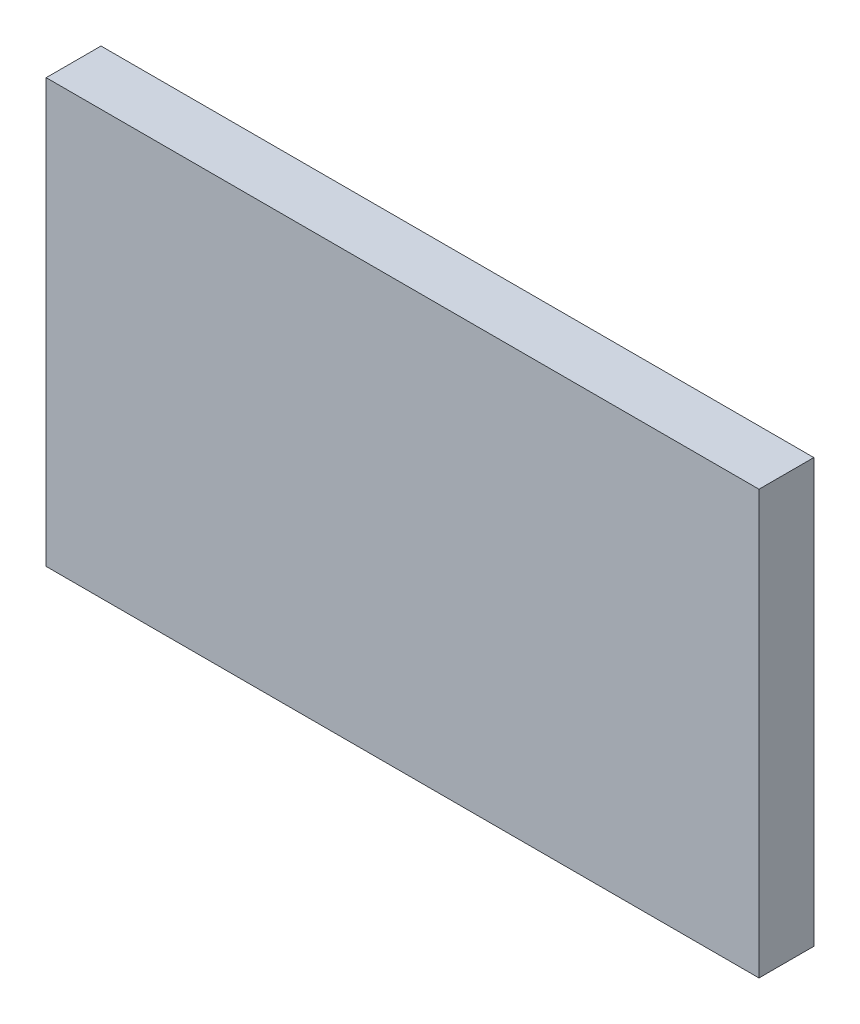
from build123d import *

# Parameters (mm, degrees)
SKETCH_1_W      = 325
SKETCH_1_H      = 193
EXTRUDE_1_DEPTH = 25


with BuildPart() as part:
    # 草图1 → 凸台-拉伸1 (new body)
    with BuildSketch(Plane.XY):
        Rectangle(SKETCH_1_W, SKETCH_1_H)
    extrude(amount=EXTRUDE_1_DEPTH)


solid = part.part
